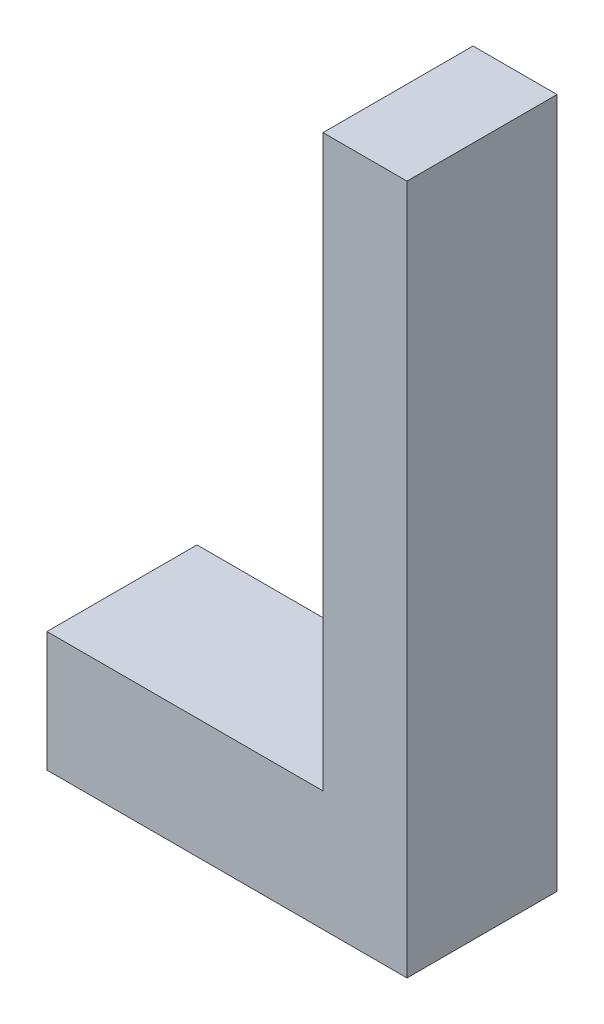
from build123d import *

# Parameters (mm, degrees)
SKETCH1_W           = 3
SKETCH1_H           = 1
BOSS_EXTRUDE1_DEPTH = 1.25
SKETCH3_W           = 0.700162323
SKETCH3_H           = 4.75
BOSS_EXTRUDE2_DEPTH = 1.25


with BuildPart() as part:
    # Sketch1 → Boss-Extrude1 (new body)
    with BuildSketch(Plane.XY):
        with Locations((1.5, 0.5)):
            Rectangle(SKETCH1_W, SKETCH1_H)
    extrude(amount=BOSS_EXTRUDE1_DEPTH)

    # Sketch3 → Boss-Extrude2 (add)
    with BuildSketch(Plane.XY.offset(1.25)):
        with Locations((2.649918839, 3.375)):
            Rectangle(SKETCH3_W, SKETCH3_H)
    extrude(amount=-BOSS_EXTRUDE2_DEPTH)


solid = part.part
